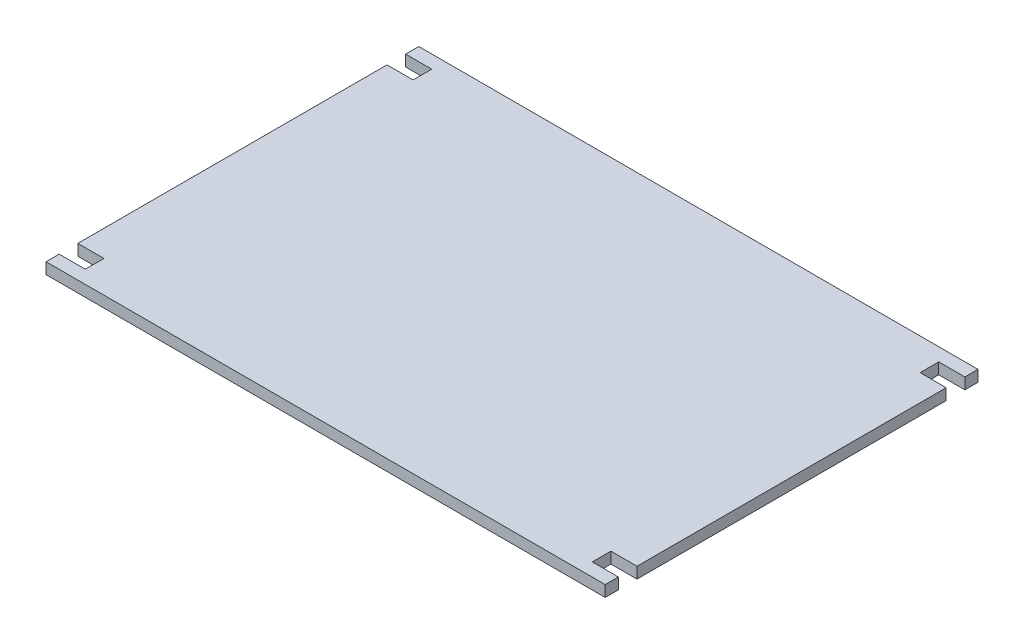
from build123d import *

# Parameters (mm, degrees)
SKETCH1_W           = 150
SKETCH1_H           = 100
BOSS_EXTRUDE1_DEPTH = 3
SKETCH2_W           = 7
SKETCH2_H           = 5
CUT_EXTRUDE1_DEPTH  = 3


with BuildPart() as part:
    # Sketch1 → Boss-Extrude1 (new body)
    with BuildSketch(Plane(origin=(0, 0, 0), x_dir=(1, 0, 0), z_dir=(0, 1, 0))):
        with Locations((75, -50)):
            Rectangle(SKETCH1_W, SKETCH1_H)
    extrude(amount=BOSS_EXTRUDE1_DEPTH)

    # Sketch2 → Cut-Extrude1 (cut)
    with BuildSketch(Plane(origin=(0, 3, 0), x_dir=(1, 0, 0), z_dir=(0, 1, 0))):
        with Locations((146.5, -93.966543848)):
            Rectangle(SKETCH2_W, SKETCH2_H)
        with Locations((146.5, -6.033456152)):
            Rectangle(SKETCH2_W, SKETCH2_H)
        with Locations((3.5, -93.966543848)):
            Rectangle(SKETCH2_W, SKETCH2_H)
        with Locations((3.5, -6.033456152)):
            Rectangle(SKETCH2_W, SKETCH2_H)
    extrude(amount=-CUT_EXTRUDE1_DEPTH, mode=Mode.SUBTRACT)


solid = part.part
